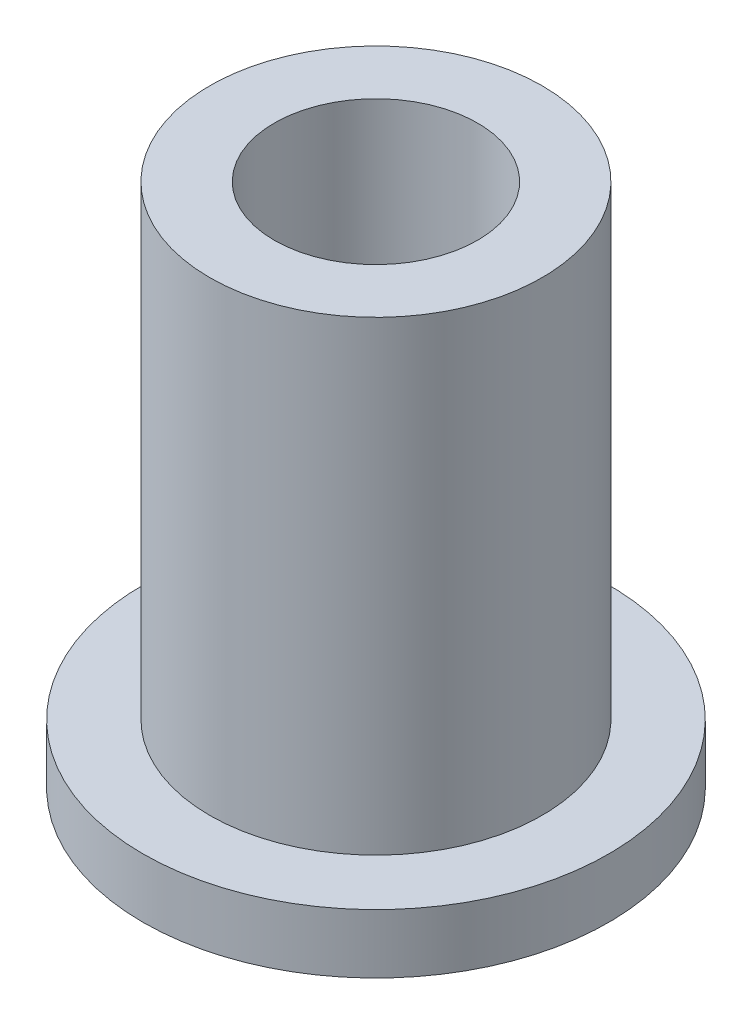
from build123d import *


with BuildPart() as part:
    # Sketch1 → Revolve1 (revolve)
    with BuildSketch(Plane(origin=(0, 0, 0), x_dir=(-1, 0, 0), z_dir=(0, 0, -1)), mode=Mode.PRIVATE) as revolve1_sk:
        Polygon((-5.5, 0), (-2.6, 0), (-2.4, 0.2), (-2.4, 12.4), (-3.925, 12.4), (-3.925, 1.4), (-5.5, 1.4), align=None)
    revolve(revolve1_sk.sketch.rotate(Axis((0, 0, 0), (0, 1, 0)), 270), axis=Axis((0, 0, 0), (0, 1, 0)))


solid = part.part
